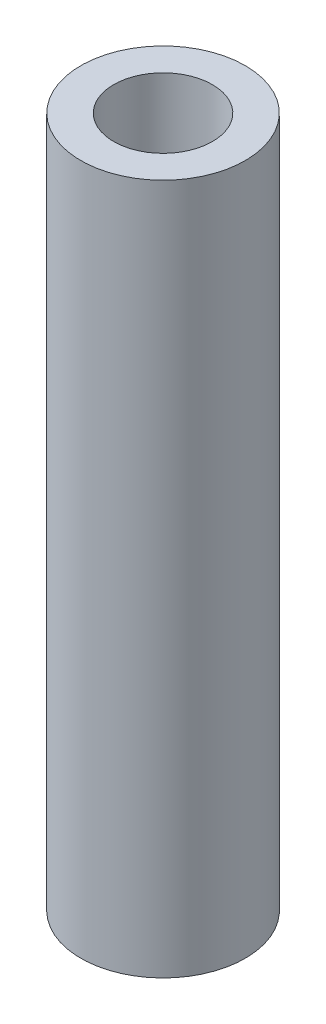
from build123d import *

# Parameters (mm, degrees)
SKETCH1_R           = 2.5
SKETCH1_R_2         = 1.5
BOSS_EXTRUDE1_DEPTH = 21


with BuildPart() as part:
    # Sketch1 → Boss-Extrude1 (new body)
    with BuildSketch(Plane(origin=(0, 0, 0), x_dir=(1, 0, 0), z_dir=(0, 1, 0))):
        with Locations(Location((0, 0, 0), (0, 0, 90))):
            Circle(SKETCH1_R)
        with Locations(Location((0, 0, 0), (0, 0, 90))):
            Circle(SKETCH1_R_2, mode=Mode.SUBTRACT)
    extrude(amount=BOSS_EXTRUDE1_DEPTH)


solid = part.part
